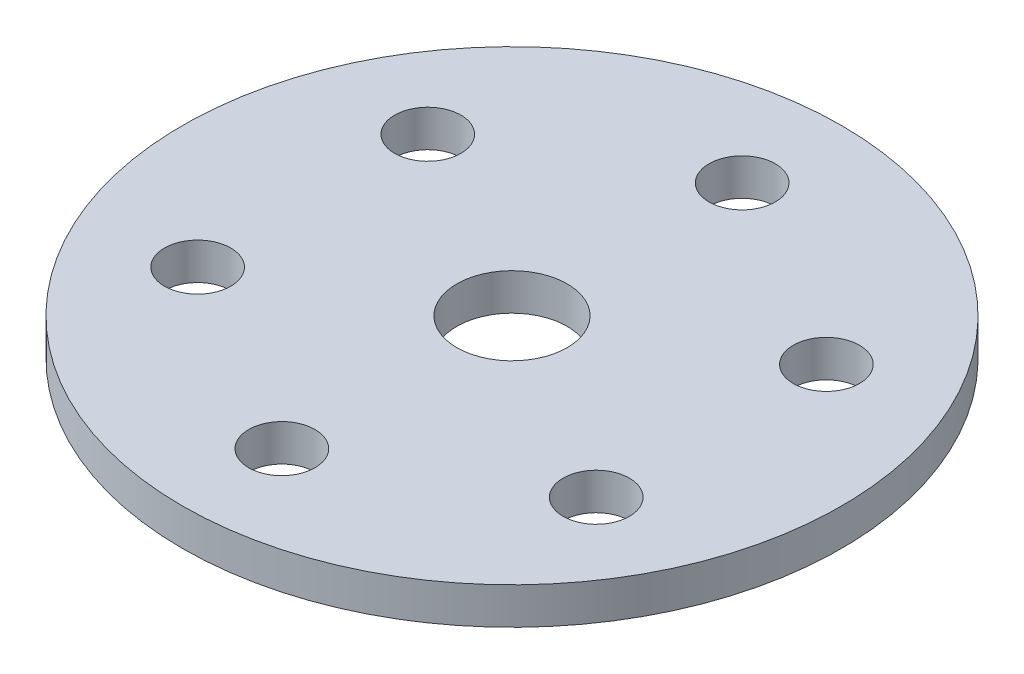
from build123d import *

# Parameters (mm, degrees)
SKETCH1_R            = 17.9
SKETCH1_R_2          = 3
BOSS_EXTRUDE1_DEPTH  = 2
M3_CLEARANCE_HOLE1_D = 3.6


with BuildPart() as part:
    # Sketch1 → Boss-Extrude1 (new body)
    with BuildSketch(Plane(origin=(0, 0, 0), x_dir=(1, 0, 0), z_dir=(0, 1, 0))):
        with Locations(Location((0, 0, 0), (0, 0, 270))):
            Circle(SKETCH1_R)
        with Locations(Location((0, 0, 0), (0, 0, 270))):
            Circle(SKETCH1_R_2, mode=Mode.SUBTRACT)
    extrude(amount=BOSS_EXTRUDE1_DEPTH)

    # M3 Clearance Hole1 (through all)
    with Locations(Plane(origin=(0, 2, 0), x_dir=(1, 0, 0), z_dir=(0, 1, 0))):
        with Locations((0, 12.5), (-10.825317547, 6.25), (-10.825317547, -6.25), (0, -12.5), (10.825317547, -6.25), (10.825317547, 6.25)):
            Hole(M3_CLEARANCE_HOLE1_D / 2)


solid = part.part
